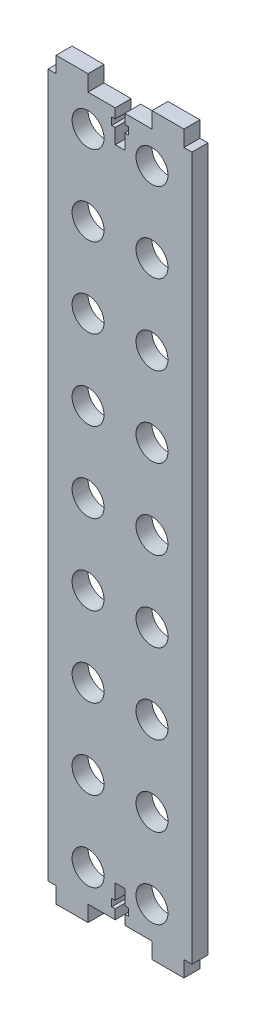
from build123d import *

# Parameters (mm, degrees)
SKETCH1_R           = 5
BOSS_EXTRUDE1_DEPTH = 5


with BuildPart() as part:
    # Sketch1 → Boss-Extrude1 (new body)
    with BuildSketch(Plane.XY):
        Polygon((-56.800385751, 0), (-54.300385751, 0), (-54.300385751, -5), (-44.300385751, -5), (-44.300385751, 0), (-35.800385751, 0), (-35.800385751, 3), (-36.900385751, 3), (-36.900385751, 5.3), (-35.800385751, 5.3), (-35.800385751, 10), (-32.800385751, 10), (-32.800385751, 5.3), (-31.700385751, 5.3), (-31.700385751, 3), (-32.800385751, 3), (-32.800385751, 0), (-24.300385751, 0), (-24.300385751, -5), (-14.300385751, -5), (-14.300385751, -0.020707798), (-11.800385751, -0.020707798), (-11.800385751, 220), (-14.300385751, 220), (-14.300385751, 225), (-24.300385751, 225), (-24.300385751, 220), (-32.800385751, 220), (-32.800385751, 217), (-31.700385751, 217), (-31.700385751, 214.7), (-32.800385751, 214.7), (-32.800385751, 210), (-35.800385751, 210), (-35.800385751, 214.7), (-36.900385751, 214.7), (-36.900385751, 217), (-35.800385751, 217), (-35.800385751, 220), (-44.300385751, 220), (-44.300385751, 225), (-54.300385751, 225), (-54.300385751, 220), (-56.800385751, 220), align=None)
        with Locations((-44.300385751, 210)):
            Circle(SKETCH1_R, mode=Mode.SUBTRACT)
        with Locations((-24.300385751, 210)):
            Circle(SKETCH1_R, mode=Mode.SUBTRACT)
        with Locations((-24.300385751, 185)):
            Circle(SKETCH1_R, mode=Mode.SUBTRACT)
        with Locations((-24.300385751, 160)):
            Circle(SKETCH1_R, mode=Mode.SUBTRACT)
        with Locations((-24.300385751, 135)):
            Circle(SKETCH1_R, mode=Mode.SUBTRACT)
        with Locations((-24.300385751, 110)):
            Circle(SKETCH1_R, mode=Mode.SUBTRACT)
        with Locations((-24.300385751, 85)):
            Circle(SKETCH1_R, mode=Mode.SUBTRACT)
        with Locations((-24.300385751, 60)):
            Circle(SKETCH1_R, mode=Mode.SUBTRACT)
        with Locations((-24.300385751, 35)):
            Circle(SKETCH1_R, mode=Mode.SUBTRACT)
        with Locations((-24.300385751, 10)):
            Circle(SKETCH1_R, mode=Mode.SUBTRACT)
        with Locations((-44.300385751, 185)):
            Circle(SKETCH1_R, mode=Mode.SUBTRACT)
        with Locations((-44.300385751, 160)):
            Circle(SKETCH1_R, mode=Mode.SUBTRACT)
        with Locations((-44.300385751, 135)):
            Circle(SKETCH1_R, mode=Mode.SUBTRACT)
        with Locations((-44.300385751, 110)):
            Circle(SKETCH1_R, mode=Mode.SUBTRACT)
        with Locations((-44.300385751, 85)):
            Circle(SKETCH1_R, mode=Mode.SUBTRACT)
        with Locations((-44.300385751, 60)):
            Circle(SKETCH1_R, mode=Mode.SUBTRACT)
        with Locations((-44.300385751, 35)):
            Circle(SKETCH1_R, mode=Mode.SUBTRACT)
        with Locations((-44.300385751, 10)):
            Circle(SKETCH1_R, mode=Mode.SUBTRACT)
    extrude(amount=BOSS_EXTRUDE1_DEPTH)


solid = part.part
